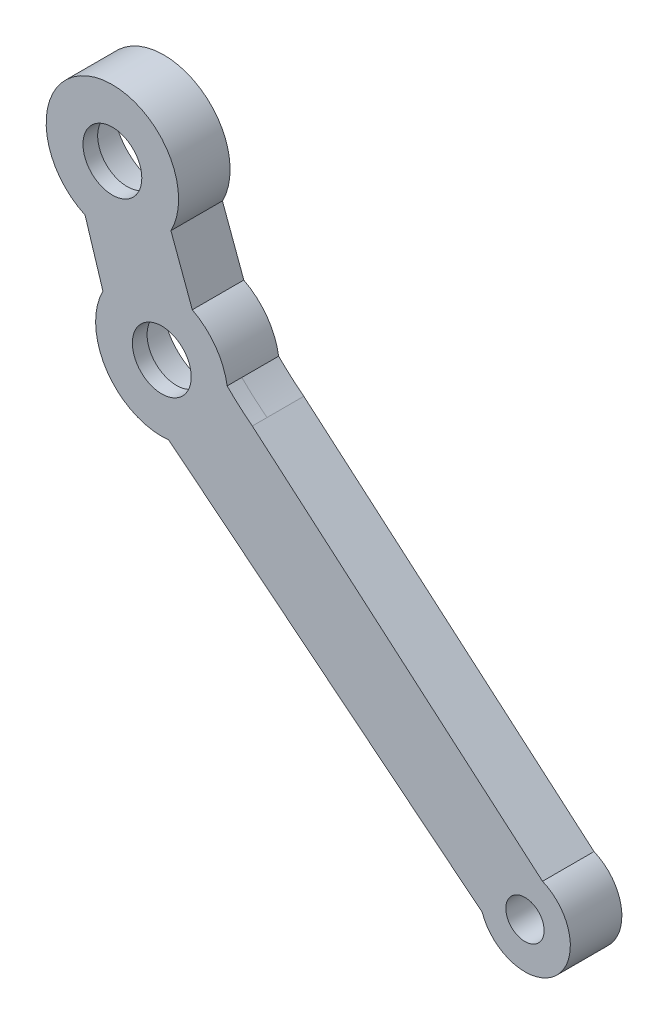
from build123d import *

# Parameters (mm, degrees)
SKETCH1_R           = 6.901519969
SKETCH1_R_2         = 6.9
SKETCH1_R_3         = 2.6
BOSS_EXTRUDE1_DEPTH = 5
SKETCH2_R           = 4
SKETCH2_R_2         = 2.6
BOSS_EXTRUDE2_DEPTH = 2


with BuildPart() as part:
    # Sketch1 → Boss-Extrude1 (new body)
    with BuildSketch(Plane.XY):
        with BuildLine():
            Line((-119.047770685, -14.21840763), (-158.491736924, 19.646141241))
            add(Edge.make_bspline(
                [(-158.491736924, 19.646141241), (-160.313597407, 21.050397122), (-161.909962094, 22.656519407)],
                knots=[0, 0, 0, 1, 1, 1], degree=2))
            ThreePointArc((-161.909962094, 22.656519407), (-163.491640093, 26.517106064), (-166.64545249, 29.248278339))
            Line((-166.64545249, 29.248278339), (-169.551288031, 37.112526103))
            ThreePointArc((-169.551288031, 37.112526103), (-180.421756419, 49.833075564), (-181.222431589, 33.119656379))
            Line((-181.222431589, 33.119656379), (-178.794316039, 25.37582765))
            ThreePointArc((-178.794316039, 25.37582765), (-178.212831269, 16.189990788), (-169.857983808, 12.328093938))
            Line((-169.857983808, 12.328093938), (-127.253789064, -21.937441374))
            ThreePointArc((-127.253789064, -21.937441374), (-117.207191003, -24.396487309), (-119.047770685, -14.21840763))
        make_face()
        with Locations((-170.794274728, 21.270925714)):
            Circle(SKETCH1_R, mode=Mode.SUBTRACT)
        with Locations((-177.508495403, 41.317624299)):
            Circle(SKETCH1_R_2, mode=Mode.SUBTRACT)
        with Locations((-121.432089481, -19.905045023)):
            Circle(SKETCH1_R_3, mode=Mode.SUBTRACT)
    extrude(amount=BOSS_EXTRUDE1_DEPTH)

    # Sketch2 → Boss-Extrude2 (add)
    with BuildSketch(Plane.XY.offset(5)):
        with BuildLine():
            Line((-119.047770685, -14.21840763), (-158.491736924, 19.646141241))
            add(Edge.make_bspline(
                [(-158.491736924, 19.646141241), (-160.313597387, 21.050397106), (-161.909962058, 22.656519371)],
                knots=[0, 0, 0, 1, 1, 1], degree=2))
            ThreePointArc((-161.909962058, 22.656519371), (-163.491640057, 26.517106064), (-166.64545249, 29.248278339))
            Line((-166.64545249, 29.248278339), (-169.551288031, 37.112526103))
            ThreePointArc((-169.551288031, 37.112526103), (-180.421756419, 49.833075564), (-181.222431589, 33.119656379))
            Line((-181.222431589, 33.119656379), (-178.794316039, 25.37582765))
            ThreePointArc((-178.794316039, 25.37582765), (-178.212831269, 16.189990788), (-169.857983808, 12.328093938))
            Line((-169.857983808, 12.328093938), (-127.253789064, -21.937441374))
            ThreePointArc((-127.253789064, -21.937441374), (-117.207191003, -24.396487309), (-119.047770685, -14.21840763))
        make_face()
        with Locations((-177.508495403, 41.317624299)):
            Circle(SKETCH2_R, mode=Mode.SUBTRACT)
        with Locations((-170.794274728, 21.270925714)):
            Circle(SKETCH2_R, mode=Mode.SUBTRACT)
        with Locations((-121.432089481, -19.905045023)):
            Circle(SKETCH2_R_2, mode=Mode.SUBTRACT)
    extrude(amount=BOSS_EXTRUDE2_DEPTH)


solid = part.part
